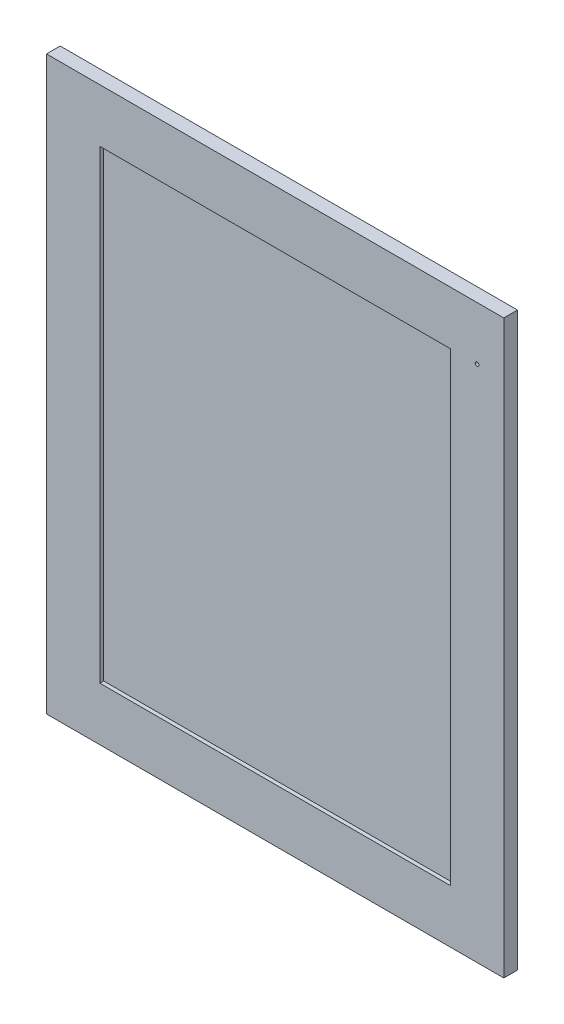
from build123d import *

# Parameters (mm, degrees)
SCHIZZO1_W         = 600
SCHIZZO1_H         = 750
PANNELLO_DEPTH     = 18
SCHIZZO2_R         = 2.5
FOROMANIGLIA_DEPTH = 961.637288471
SCHIZZO3_W         = 460
SCHIZZO3_H         = 610
LAVORAZIONE_DEPTH  = 5


with BuildPart() as part:
    # Schizzo1 → Pannello (new body)
    with BuildSketch(Plane.XY):
        with Locations((-300, -375)):
            Rectangle(SCHIZZO1_W, SCHIZZO1_H)
    extrude(amount=-PANNELLO_DEPTH)

    # Schizzo2 → ForoManiglia (cut, through all)
    with BuildSketch(Plane.XY):
        with Locations((-35, -70)):
            Circle(SCHIZZO2_R)
    extrude(amount=-FOROMANIGLIA_DEPTH, mode=Mode.SUBTRACT)

    # Schizzo3 → Lavorazione (cut)
    with BuildSketch(Plane.XY):
        with Locations((-300, -375)):
            Rectangle(SCHIZZO3_W, SCHIZZO3_H)
    extrude(amount=-LAVORAZIONE_DEPTH, mode=Mode.SUBTRACT)


solid = part.part
